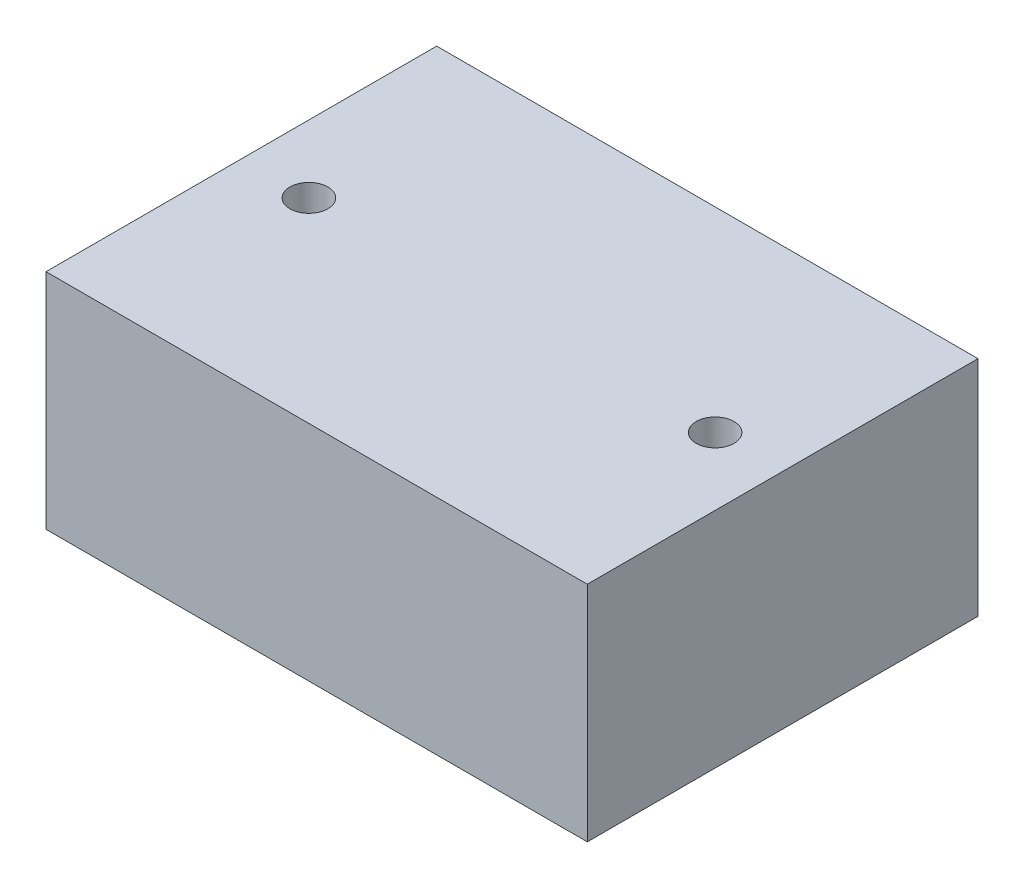
from build123d import *

# Parameters (mm, degrees)
SKETCH1_W           = 62.85
SKETCH1_H           = 45.36
BOSS_EXTRUDE1_DEPTH = 25.91
SKETCH2_R           = 2.2
CUT_EXTRUDE1_DEPTH  = 25.91


with BuildPart() as part:
    # Sketch1 → Boss-Extrude1 (new body)
    with BuildSketch(Plane(origin=(0, 0, 0), x_dir=(1, 0, 0), z_dir=(0, 1, 0))):
        Rectangle(SKETCH1_W, SKETCH1_H)
    extrude(amount=BOSS_EXTRUDE1_DEPTH)

    # Sketch2 → Cut-Extrude1 (cut)
    with BuildSketch(Plane.XZ):
        with Locations(Location((23.585, 0, 0), (0, 0, 270))):
            Circle(SKETCH2_R)
    cut_extrude1 = extrude(amount=-CUT_EXTRUDE1_DEPTH, mode=Mode.SUBTRACT)

    # Mirror1: Cut-Extrude1 across plane
    add(cut_extrude1.mirror(Plane(origin=(0, 0, 0), x_dir=(0, 0, 1), z_dir=(1, 0, 0))), mode=Mode.SUBTRACT)


solid = part.part
